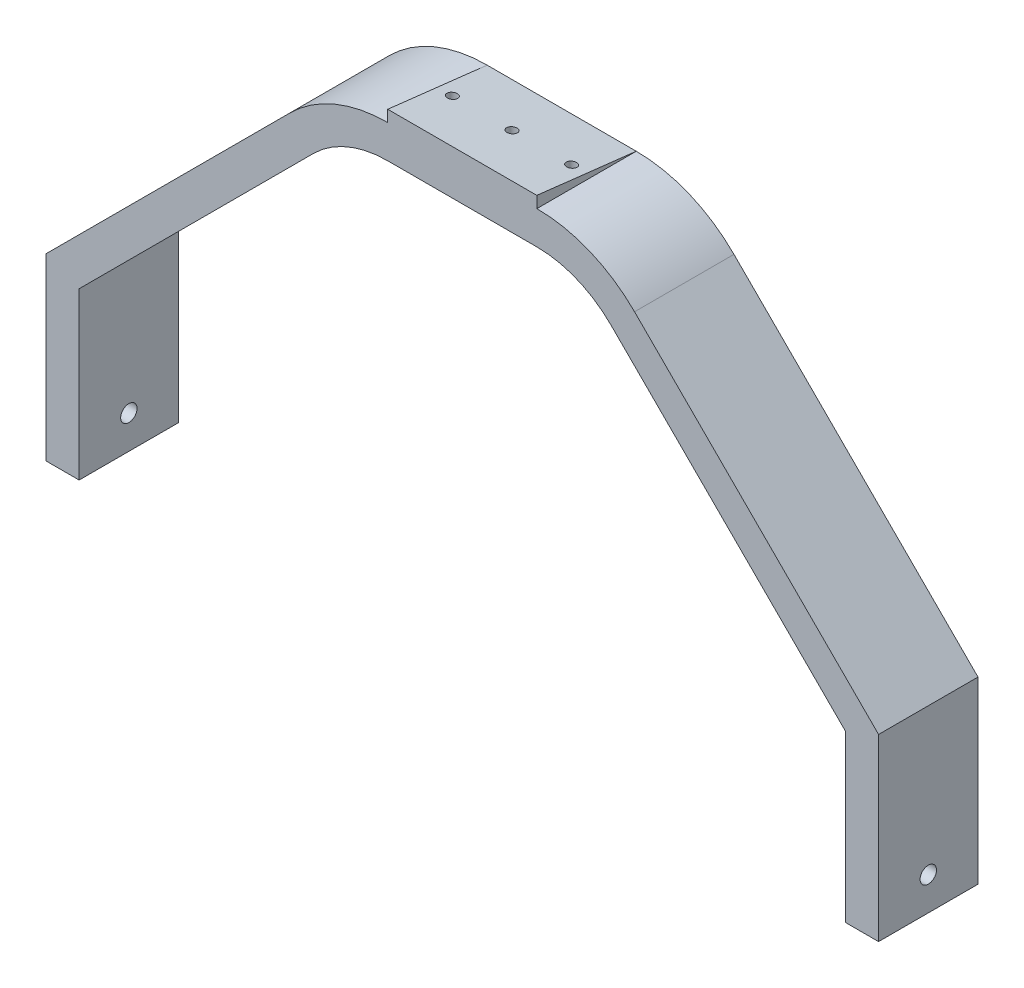
from build123d import *

# Parameters (mm, degrees)
SALIENTE_EXTRUIR1_DEPTH = 30
CROQUIS3_R              = 2.475
CORTAR_EXTRUIR1_DEPTH   = 287.780312831
CROQUIS4_R              = 1.5
CORTAR_EXTRUIR2_DEPTH   = 191.467453482
CROQUIS5_W              = 45
CROQUIS5_H              = 30
SALIENTE_EXTRUIR2_DEPTH = 12
CORTAR_EXTRUIR3_DEPTH   = 203.637632672
CROQUIS7_R              = 1.5
CORTAR_EXTRUIR4_DEPTH   = 184.243021226


with BuildPart() as part:
    # Croquis1 → Saliente-Extruir1 (new body)
    with BuildSketch(Plane.XY):
        with BuildLine():
            Line((-22.5, -5), (22.5, -5))
            ThreePointArc((22.5, -5), (34.627023925, -7.412215038), (44.90781839, -14.28162228))
            Line((44.90781839, -14.28162228), (115.618496509, -84.992300399))
            Line((115.618496509, -84.992300399), (115.618496509, -134.992300399))
            Line((115.618496509, -134.992300399), (125.618496509, -134.992300399))
            Line((125.618496509, -134.992300399), (125.618496509, -80.850164775))
            Line((125.618496509, -80.850164775), (122.689564321, -77.921232587))
            Line((122.689564321, -77.921232587), (51.978886202, -7.210554468))
            ThreePointArc((51.978886202, -7.210554468), (38.453858249, 1.826580287), (22.5, 5))
            Line((22.5, 5), (-22.5, 5))
            ThreePointArc((-22.5, 5), (-38.453858249, 1.826580287), (-51.978886202, -7.210554468))
            Line((-51.978886202, -7.210554468), (-122.689564321, -77.921232587))
            Line((-122.689564321, -77.921232587), (-125.618496509, -80.850164775))
            Line((-125.618496509, -80.850164775), (-125.618496509, -134.992300399))
            Line((-125.618496509, -134.992300399), (-115.618496509, -134.992300399))
            Line((-115.618496509, -134.992300399), (-115.618496509, -84.992300399))
            Line((-115.618496509, -84.992300399), (-44.90781839, -14.28162228))
            ThreePointArc((-44.90781839, -14.28162228), (-34.627023925, -7.412215038), (-22.5, -5))
        make_face()
    extrude(amount=SALIENTE_EXTRUIR1_DEPTH)

    # Croquis3 → Cortar-Extruir1 (cut, through all)
    with BuildSketch(Plane.ZY.offset(125.618496509)):
        with Locations((15, -124.992300399)):
            Circle(CROQUIS3_R)
    extrude(amount=-CORTAR_EXTRUIR1_DEPTH, mode=Mode.SUBTRACT)

    # Croquis4 → Cortar-Extruir2 (cut, through all)
    with BuildSketch(Plane(origin=(0, 5, 0), x_dir=(1, 0, 0), z_dir=(0, 1, 0))):
        with Locations(Location((0, -15, 0), (0, 0, 270))):
            Circle(CROQUIS4_R)
        with Locations(Location((18, -15, 0), (0, 0, 270))):
            Circle(CROQUIS4_R)
        with Locations(Location((-18, -15, 0), (0, 0, 270))):
            Circle(CROQUIS4_R)
    extrude(amount=-CORTAR_EXTRUIR2_DEPTH, mode=Mode.SUBTRACT)

    # Croquis5 → Saliente-Extruir2 (add)
    with BuildSketch(Plane(origin=(0, 5, 0), x_dir=(1, 0, 0), z_dir=(0, 1, 0))):
        with Locations((0, -15)):
            Rectangle(CROQUIS5_W, CROQUIS5_H)
    extrude(amount=SALIENTE_EXTRUIR2_DEPTH)

    # Croquis6 → Cortar-Extruir3 (cut, through all)
    with BuildSketch(Plane(origin=(22.5, 0, 0), x_dir=(0, 0, -1), z_dir=(1, 0, 0))):
        Polygon((0, 5), (-30, 8.47111843), (-30, 19.923097654), (0, 19.923097654), align=None)
    extrude(amount=-CORTAR_EXTRUIR3_DEPTH, mode=Mode.SUBTRACT)

    # Croquis7 → Cortar-Extruir4 (cut, through all)
    with BuildSketch(Plane.XZ.offset(5)):
        with Locations(Location((0, 15, 0), (0, 0, 90))):
            Circle(CROQUIS7_R)
        with Locations(Location((-18, 15, 0), (0, 0, 90))):
            Circle(CROQUIS7_R)
        with Locations(Location((18, 15, 0), (0, 0, 90))):
            Circle(CROQUIS7_R)
    extrude(amount=-CORTAR_EXTRUIR4_DEPTH, mode=Mode.SUBTRACT)


solid = part.part
